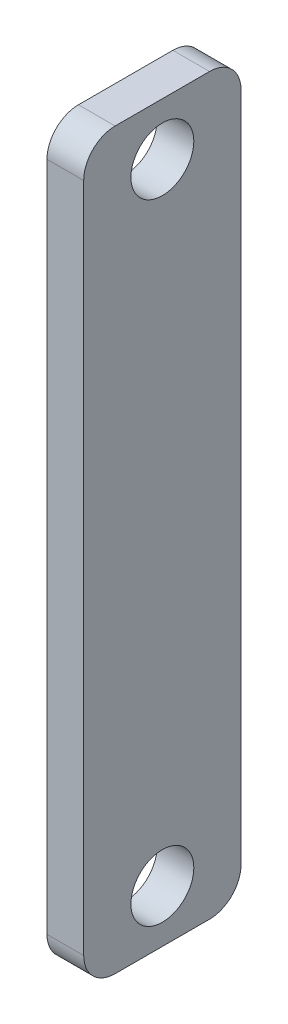
from build123d import *

# Parameters (mm, degrees)
SKETCH3_R           = 3
BOSS_EXTRUDE2_DEPTH = 1.75


with BuildPart() as part:
    # Sketch3 → Boss-Extrude2 (new, symmetric)
    with BuildSketch(Plane(origin=(0, 0, 0), x_dir=(0, 0, -1), z_dir=(1, 0, 0))):
        with BuildLine():
            Line((3, 0), (12, 0))
            ThreePointArc((12, 0), (14.121320344, -0.878679656), (15, -3))
            Line((15, -3), (15, -67))
            ThreePointArc((15, -67), (14.121320344, -69.121320344), (12, -70))
            Line((12, -70), (3, -70))
            ThreePointArc((3, -70), (0.878679656, -69.121320344), (0, -67))
            Line((0, -67), (0, -3))
            ThreePointArc((0, -3), (0.878679656, -0.878679656), (3, 0))
        make_face()
        with Locations((7.5, -5)):
            Circle(SKETCH3_R, mode=Mode.SUBTRACT)
        with Locations((7.5, -65)):
            Circle(SKETCH3_R, mode=Mode.SUBTRACT)
    extrude(amount=BOSS_EXTRUDE2_DEPTH, both=True)


solid = part.part
